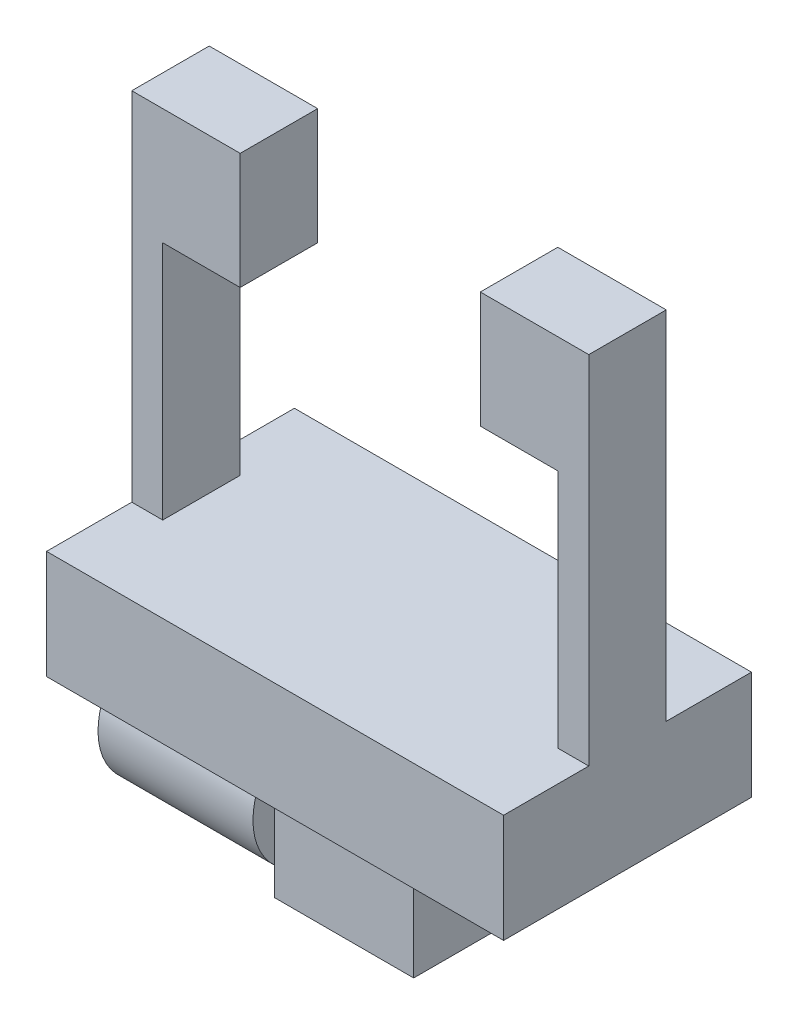
from build123d import *

# Parameters (mm, degrees)
SKETCH1_W           = 74.93
SKETCH1_H           = 17.78
BOSS_EXTRUDE1_DEPTH = 20.32
SKETCH2_W           = 5.08
SKETCH2_H           = 39.37
BOSS_EXTRUDE2_DEPTH = 6.35
SKETCH3_W           = 17.78
SKETCH3_H           = 19.05
BOSS_EXTRUDE3_DEPTH = 6.35
SKETCH5_W           = 22.86
SKETCH5_H           = 25.4
BOSS_EXTRUDE4_DEPTH = 7.62
SKETCH6_R           = 11.1125
BOSS_EXTRUDE5_DEPTH = 25.4


with BuildPart() as part:
    # Sketch1 → Boss-Extrude1 (new, symmetric)
    with BuildSketch(Plane.XY):
        Rectangle(SKETCH1_W, SKETCH1_H)
    extrude(amount=BOSS_EXTRUDE1_DEPTH, both=True)

    # Sketch2 → Boss-Extrude2 (add, symmetric)
    with BuildSketch(Plane.XY):
        with Locations((-34.925, 28.575)):
            Rectangle(SKETCH2_W, SKETCH2_H)
        with Locations((34.925, 28.575)):
            Rectangle(SKETCH2_W, SKETCH2_H)
    extrude(amount=BOSS_EXTRUDE2_DEPTH, both=True)

    # Sketch3 → Boss-Extrude3 (add, symmetric)
    with BuildSketch(Plane.XY):
        with Locations((28.575, 57.785)):
            Rectangle(SKETCH3_W, SKETCH3_H)
        with Locations((-28.575, 57.785)):
            Rectangle(SKETCH3_W, SKETCH3_H)
    extrude(amount=BOSS_EXTRUDE3_DEPTH, both=True)

    # Sketch5 → Boss-Extrude4 (add, symmetric)
    with BuildSketch(Plane.XY):
        with Locations((-1.402012412, -21.59)):
            Rectangle(SKETCH5_W, SKETCH5_H)
    extrude(amount=BOSS_EXTRUDE4_DEPTH, both=True)

    # Sketch6 → Boss-Extrude5 (add)
    with BuildSketch(Plane.ZY.offset(12.832012412)):
        with Locations(Location((0, -21.59, 0), (0, 0, 46.708192407))):
            Circle(SKETCH6_R)
    extrude(amount=BOSS_EXTRUDE5_DEPTH)


solid = part.part
